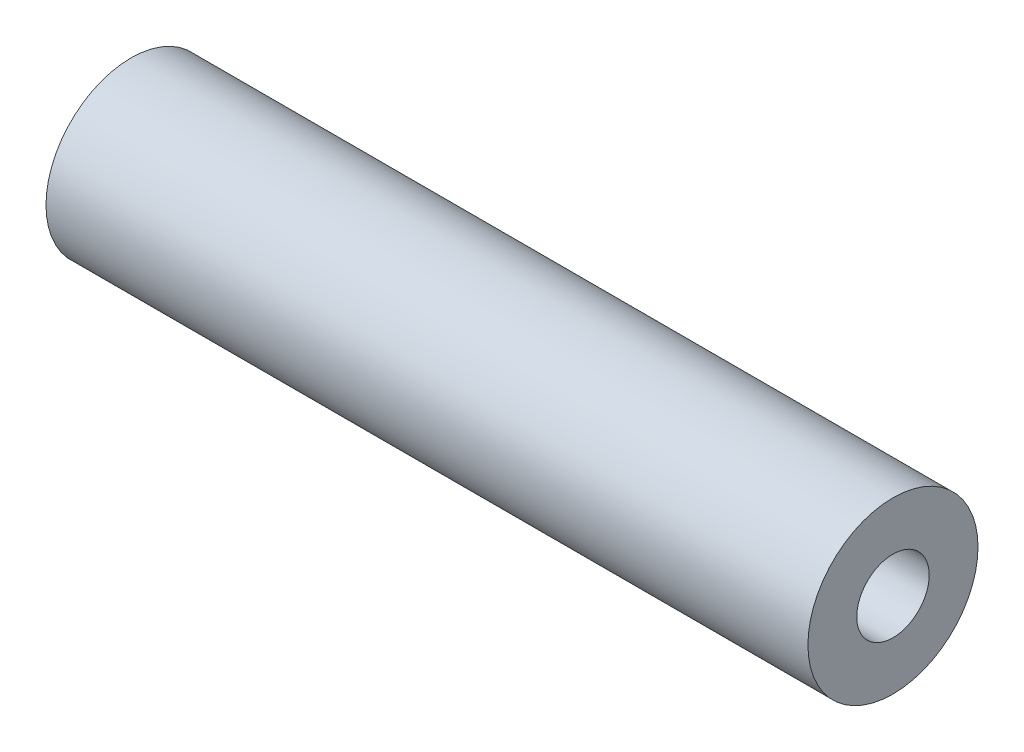
from build123d import *

# Parameters (mm, degrees)
SKETCH1_R             = 3.175
BOSS_EXTRUDE1_DEPTH   = 28.448
F_6_32_TAPPED_HOLE1_D = 2.7051


with BuildPart() as part:
    # Sketch1 → Boss-Extrude1 (new body)
    with BuildSketch(Plane(origin=(0, 0, 0), x_dir=(0, 0, -1), z_dir=(1, 0, 0))):
        Circle(SKETCH1_R)
    extrude(amount=BOSS_EXTRUDE1_DEPTH)

    # #6-32 Tapped Hole1 (through all)
    with Locations(Plane(origin=(28.448, 0, 0), x_dir=(0, 0, -1), z_dir=(1, 0, 0))):
        with Locations((0, 0)):
            Hole(F_6_32_TAPPED_HOLE1_D / 2)


solid = part.part
